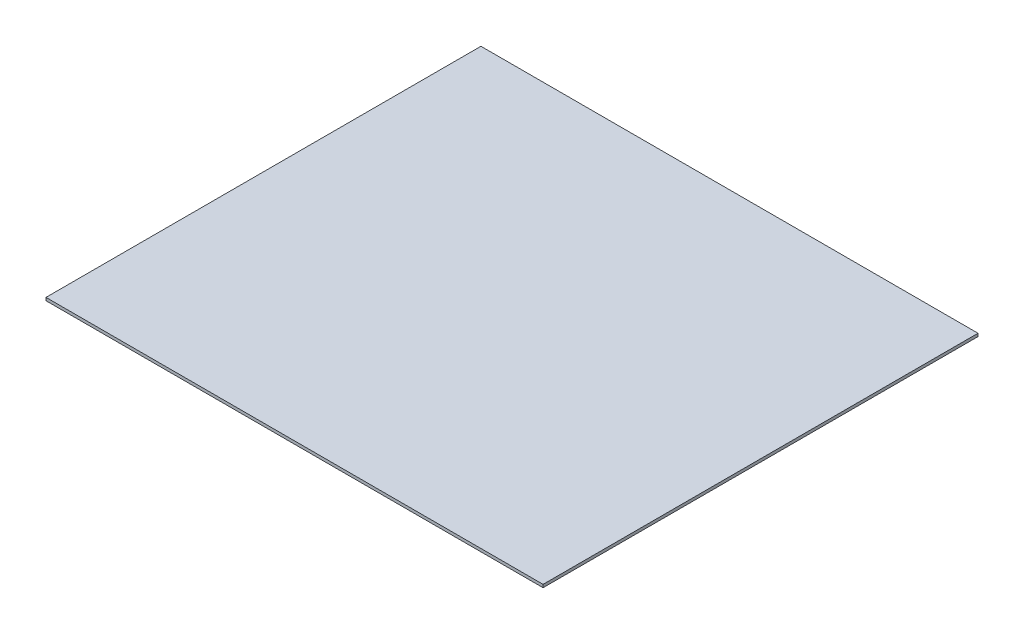
from build123d import *

# Parameters (mm, degrees)
SKETCH1_W           = 812.8
SKETCH1_H           = 711.2
BOSS_EXTRUDE1_DEPTH = 4.8


with BuildPart() as part:
    # Sketch1 → Boss-Extrude1 (new body)
    with BuildSketch(Plane(origin=(0, 0, 0), x_dir=(1, 0, 0), z_dir=(0, 1, 0))):
        Rectangle(SKETCH1_W, SKETCH1_H)
    extrude(amount=BOSS_EXTRUDE1_DEPTH)


solid = part.part
